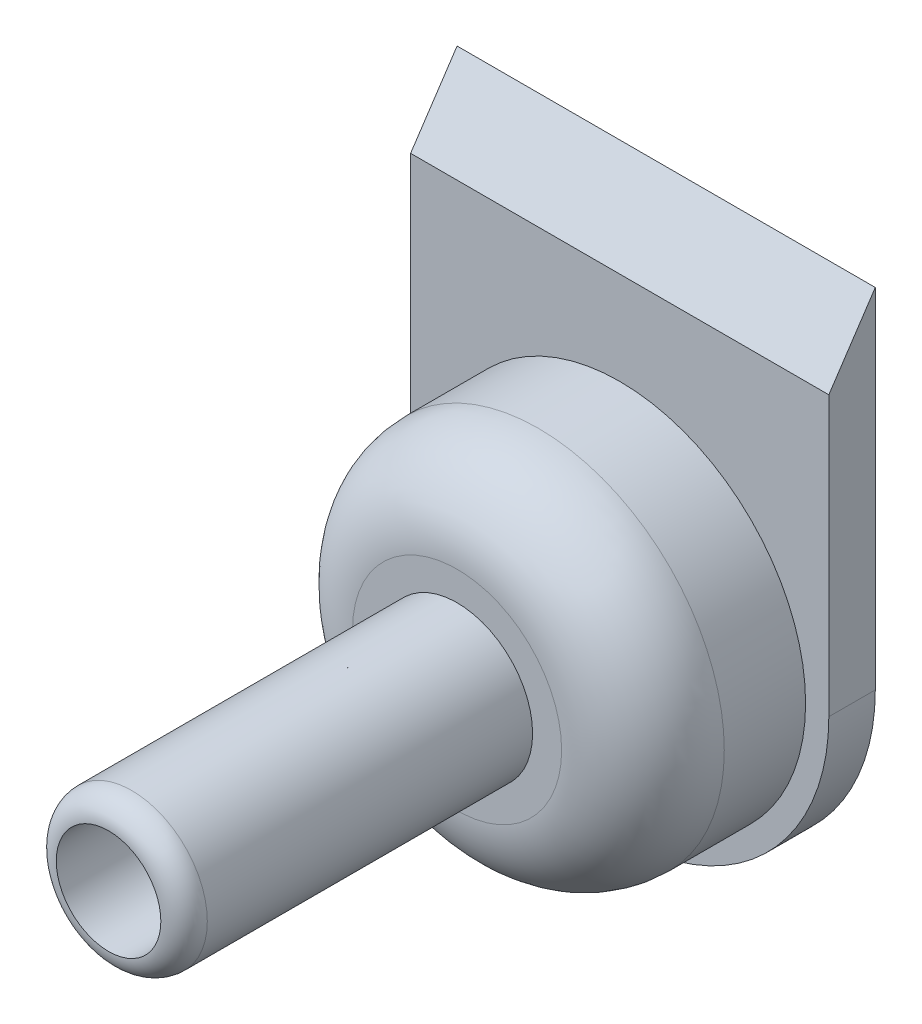
from build123d import *

# Parameters (mm, degrees)
SZKIC1_R                         = 6.5
DODANIE_WYCI_GNI_CIE1_DEPTH      = 30
ZAOKR_GLENIE1_R                  = 2
SZKIC2_R                         = 4.5
WYTNIJ_WYCI_GNI_CIE1_DEPTH       = 30
SZKIC3_R                         = 16
DODANIE_WYCI_GNI_CIE2_DEPTH      = 14
ZAOKR_GLENIE2_R                  = 7
SZKIC4_R                         = 18
DODANIE_WYCI_GNI_CIE3_DEPTH      = 4
DODANIE_WYCI_GNI_CIE4_REACH      = 61.397
DODANIE_WYCI_GNI_CIE4_END_RADIUS = 18
SZKIC5_W                         = 36
SZKIC5_H                         = 4
WYTNIJ_WYCI_GNI_CIE2_REACH       = 57.642


with BuildPart() as part:
    # Szkic1 → Dodanie-wyciągnięcie1 (new body)
    with BuildSketch(Plane.XY):
        Circle(SZKIC1_R)
    extrude(amount=DODANIE_WYCI_GNI_CIE1_DEPTH)

    # Zaokrąglenie1
    zaokr_glenie1_edges = [part.edges().sort_by_distance(p)[0] for p in [
        (-6.5, 0, 30),
    ]]
    fillet(zaokr_glenie1_edges, radius=ZAOKR_GLENIE1_R)

    # Szkic2 → Wytnij-wyciągnięcie1 (cut)
    with BuildSketch(Plane(origin=(0, 0, 0), x_dir=(-1, 0, 0), z_dir=(0, 0, -1))):
        Circle(SZKIC2_R)
    extrude(amount=-WYTNIJ_WYCI_GNI_CIE1_DEPTH, mode=Mode.SUBTRACT)

    # Szkic3 → Dodanie-wyciągnięcie2 (add)
    with BuildSketch(Plane(origin=(0, 0, 0), x_dir=(-1, 0, 0), z_dir=(0, 0, -1))):
        Circle(SZKIC3_R)
    extrude(amount=DODANIE_WYCI_GNI_CIE2_DEPTH)

    # Zaokrąglenie2
    zaokr_glenie2_edges = [part.edges().sort_by_distance(p)[0] for p in [
        (16, 0, 0),
    ]]
    fillet(zaokr_glenie2_edges, radius=ZAOKR_GLENIE2_R)

    # Szkic4 → Dodanie-wyciągnięcie3 (add)
    with BuildSketch(Plane(origin=(0, 0, -14), x_dir=(-1, 0, 0), z_dir=(0, 0, -1))):
        Circle(SZKIC4_R)
    extrude(amount=DODANIE_WYCI_GNI_CIE3_DEPTH)

    # Dodanie-wyciągnięcie4: up to this cylinder (the profile starts outside it)
    dodanie_wyci_gni_cie4_end = Plane(origin=(0, 0, -16), z_dir=(0, 0, 1)) * Cylinder(DODANIE_WYCI_GNI_CIE4_END_RADIUS, 159.794, mode=Mode.PRIVATE)
    # Szkic5 → Dodanie-wyciągnięcie4 (add, up to the surface)
    with BuildSketch(Plane(origin=(0, 30, 0), x_dir=(1, 0, 0), z_dir=(0, 1, 0)), mode=Mode.PRIVATE) as dodanie_wyci_gni_cie4_sk1:
        with Locations((0, 16)):
            Rectangle(SZKIC5_W, SZKIC5_H)
    dodanie_wyci_gni_cie4_tool1 = extrude(dodanie_wyci_gni_cie4_sk1.sketch, amount=-DODANIE_WYCI_GNI_CIE4_REACH, mode=Mode.PRIVATE) - dodanie_wyci_gni_cie4_end
    add(dodanie_wyci_gni_cie4_tool1.solids().sort_by_distance((0, 30, -16))[0])

    # Szkic6 → Wytnij-wyciągnięcie2 (cut, up to next)
    with BuildSketch(Plane(origin=(18, 0, 0), x_dir=(0, 0, -1), z_dir=(1, 0, 0)), mode=Mode.PRIVATE) as wytnij_wyci_gni_cie2_sk1:
        Polygon((18, 30), (14, 24), (14, 30), align=None)
    wytnij_wyci_gni_cie2_tool1 = extrude(wytnij_wyci_gni_cie2_sk1.sketch, amount=-WYTNIJ_WYCI_GNI_CIE2_REACH, mode=Mode.PRIVATE) & part.part
    add(wytnij_wyci_gni_cie2_tool1.solids().sort_by_distance((18, 28, -15.333333))[0], mode=Mode.SUBTRACT)


solid = part.part
